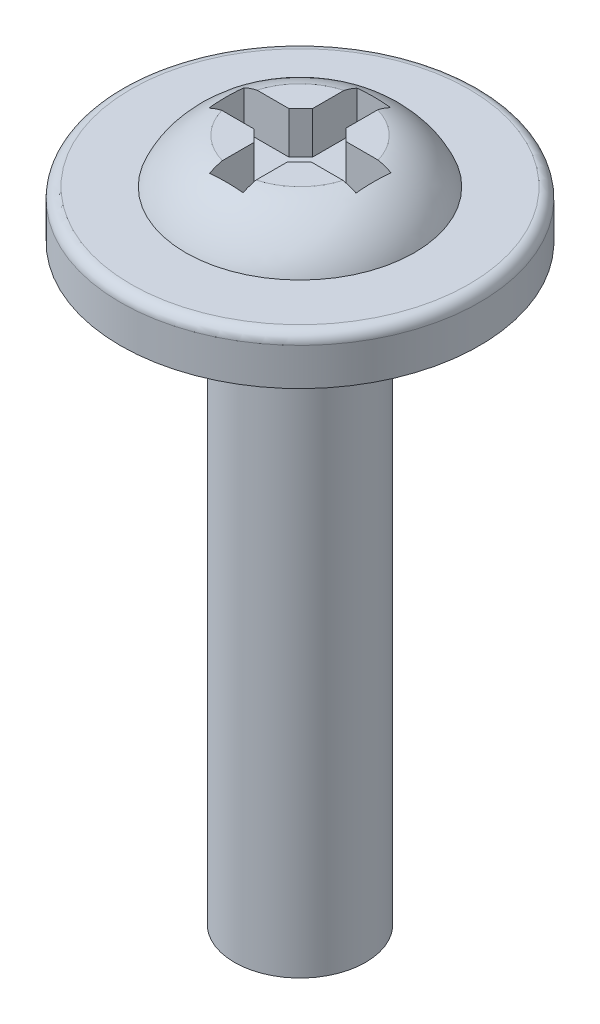
from build123d import *

# Parameters (mm, degrees)
SKETCH2_W          = 1.9812
SKETCH2_H          = 12.7
CUT_EXTRUDE1_DEPTH = 1.27
FILLET1_R          = 0.3175


with BuildPart() as part:
    # Sketch2 → Revolve2 (revolve)
    with BuildSketch(Plane(origin=(0, 0, 0), x_dir=(0, 0, -1), z_dir=(1, 0, 0))):
        with BuildLine():
            Line((0, 15.494), (0, 14.1478))
            Line((0, 14.1478), (3.4544, 14.1478))
            add(Edge.make_bspline(
                [(1.905, 15.494), (2.485859984, 15.363201575), (3.169812282, 14.831844182), (3.4544, 14.1478)],
                knots=[0, 0, 0, 0, 1, 1, 1, 1], degree=3))
            Line((1.905, 15.494), (0, 15.494))
        make_face()
        Polygon((0, 14.1478), (0, 12.7), (1.9812, 12.7), (5.4229, 12.7), (5.4229, 14.1478), (3.4544, 14.1478), align=None)
        with Locations((0.9906, 6.35)):
            Rectangle(SKETCH2_W, SKETCH2_H)
        Polygon((1.9812, -5.152618014), (0, -6.35), (0, 0), (1.9812, 0), align=None)
    revolve(axis=Axis((0, 0, 0), (0, 1, 0)))

    # Sketch4 → Cut-Extrude1 (cut)
    with BuildSketch(Plane(origin=(0, 15.494, 0), x_dir=(1, 0, 0), z_dir=(0, 1, 0))):
        Polygon((-0.508, 2.228840954), (0.508, 2.228840954), (0.508, 0.884564976), (0.861964761, 0.530600214), (2.223569071, 0.530600214), (2.223569071, -0.530600214), (0.861964761, -0.530600214), (0.508, -0.884564976), (0.508, -2.228840954), (-0.508, -2.228840954), (-0.508, -0.884564976), (-0.861964761, -0.530600214), (-2.223569071, -0.530600214), (-2.223569071, 0.530600214), (-0.861964761, 0.530600214), (-0.508, 0.884564976), align=None)
    extrude(amount=-CUT_EXTRUDE1_DEPTH, mode=Mode.SUBTRACT)

    # Fillet1
    fillet1_edges = [part.edges().sort_by_distance(p)[0] for p in [
        (0, 14.1478, 5.4229),
    ]]
    fillet(fillet1_edges, radius=FILLET1_R)


solid = part.part
